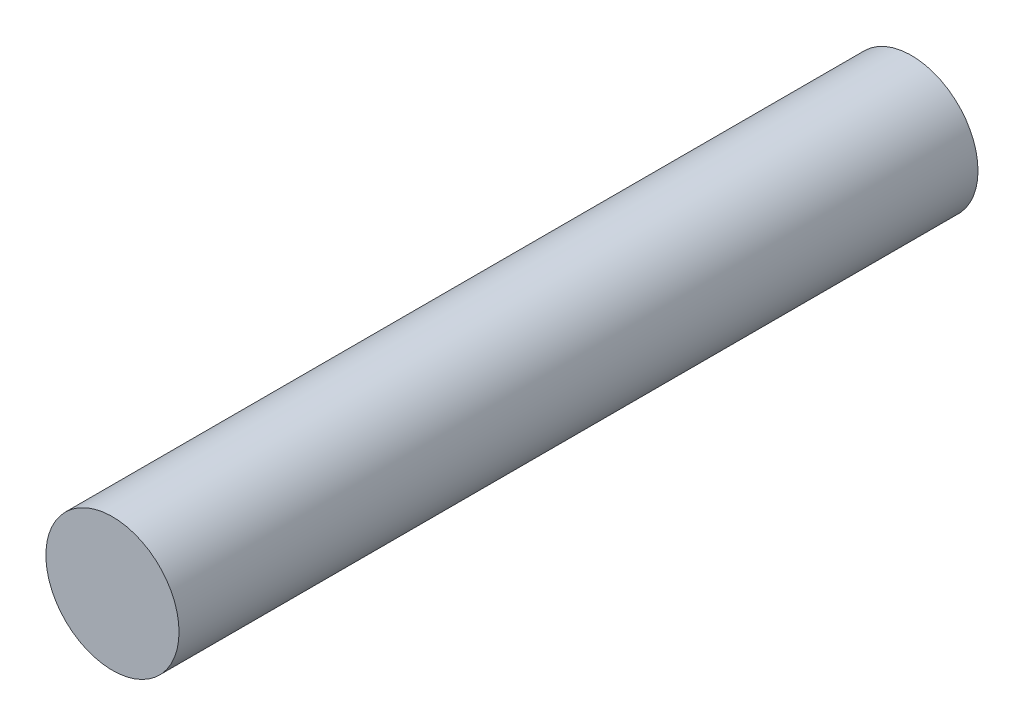
from build123d import *

# Parameters (mm, degrees)
SKETCH1_R           = 12.7
BOSS_EXTRUDE1_DEPTH = 152.4


with BuildPart() as part:
    # Sketch1 → Boss-Extrude1 (new body)
    with BuildSketch(Plane.XY):
        Circle(SKETCH1_R)
    extrude(amount=BOSS_EXTRUDE1_DEPTH)


solid = part.part
